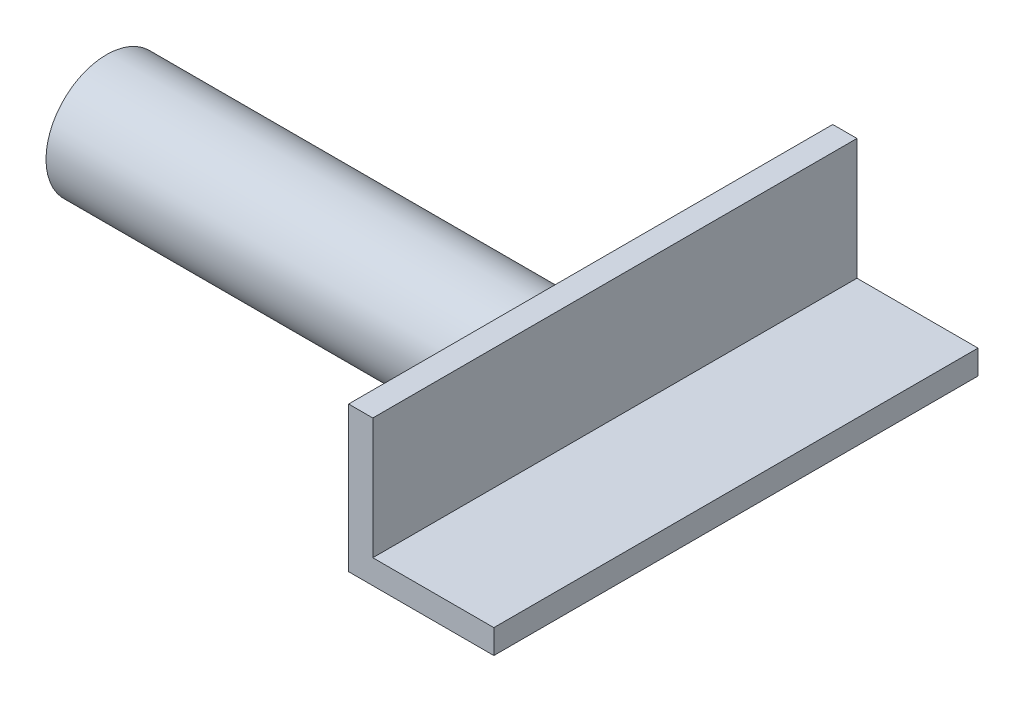
from build123d import *

# Parameters (mm, degrees)
BOSS_EXTRU_1_DEPTH = 40
ESQUISSE2_R        = 5
BOSS_EXTRU_2_DEPTH = 40


with BuildPart() as part:
    # Esquisse1 → Boss.-Extru.1 (new body)
    with BuildSketch(Plane.XY):
        Polygon((0, 0), (0, 12), (2, 12), (2, 2), (12, 2), (12, 0), align=None)
    extrude(amount=BOSS_EXTRU_1_DEPTH)

    # Esquisse2 → Boss.-Extru.2 (add)
    with BuildSketch(Plane.ZY):
        with Locations(Location((20, 2, 0), (0, 0, 203.578178478))):
            Circle(ESQUISSE2_R)
    extrude(amount=BOSS_EXTRU_2_DEPTH)


solid = part.part
